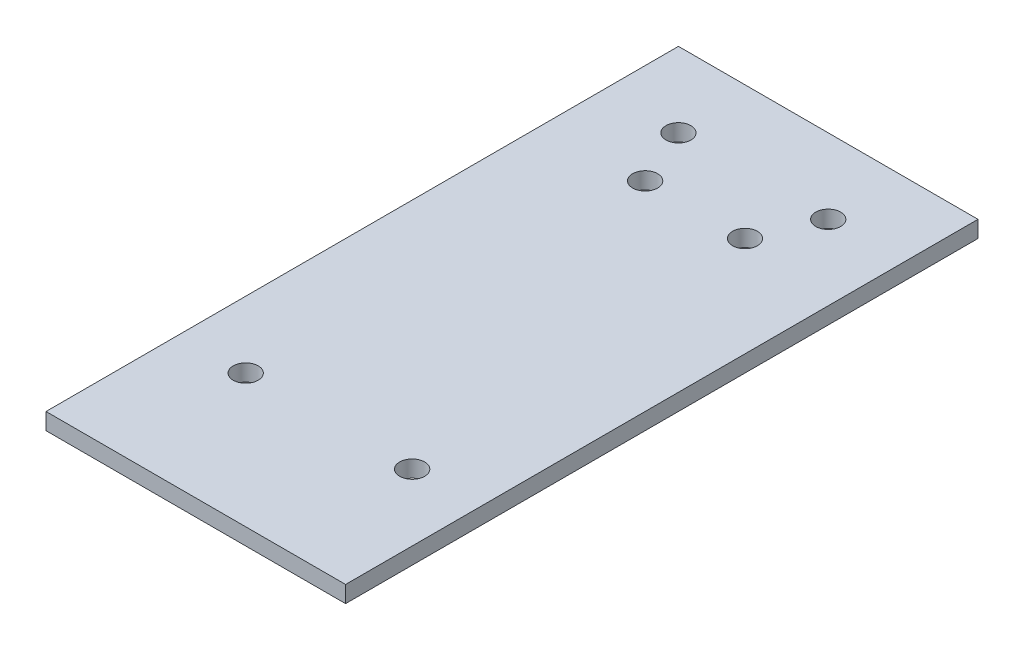
from build123d import *

# Parameters (mm, degrees)
BOSS_EXTRUDE2_DEPTH = 2.5
SKETCH5_R           = 3.75
CUT_EXTRUDE2_DEPTH  = 5
CUT_EXTRUDE3_DEPTH  = 10


with BuildPart() as part:
    # Sketch3 → Boss-Extrude2 (new, symmetric)
    with BuildSketch(Plane(origin=(0, 0, 0), x_dir=(1, 0, 0), z_dir=(0, 1, 0))):
        with BuildLine():
            Line((70, 30), (70, 10))
            ThreePointArc((70, 10), (67.071067812, 2.928932188), (60, 0))
            Line((60, 0), (-60, 0))
            ThreePointArc((-60, 0), (-67.071067812, 2.928932188), (-70, 10))
            Line((-70, 10), (-70, 30))
            ThreePointArc((-70, 30), (-68.535533906, 33.535533906), (-65, 35))
            Line((-65, 35), (-45, 35))
            Line((-45, 35), (-45, 103))
            Line((-45, 103), (-60, 103))
            ThreePointArc((-60, 103), (-67.071067812, 105.928932188), (-70, 113))
            Line((-70, 113), (-70, 147))
            ThreePointArc((-70, 147), (-67.071067812, 154.071067812), (-60, 157))
            Line((-60, 157), (-45, 157))
            Line((-45, 157), (-45, 225))
            Line((-45, 225), (-65.064414928, 225))
            ThreePointArc((-65.064414928, 225), (-68.304785278, 226.192113447), (-70, 229.2))
            Line((-70, 229.2), (-70, 245))
            ThreePointArc((-70, 245), (-66.467868189, 254.855318839), (-57.35, 260))
            Line((-57.35, 260), (57.35, 260))
            ThreePointArc((57.35, 260), (66.467868189, 254.855318839), (70, 245))
            Line((70, 245), (70, 229.2))
            ThreePointArc((70, 229.2), (68.304785278, 226.192113447), (65.064414928, 225))
            Line((65.064414928, 225), (45, 225))
            Line((45, 225), (45, 157))
            Line((45, 157), (60, 157))
            ThreePointArc((60, 157), (67.071067812, 154.071067812), (70, 147))
            Line((70, 147), (70, 113))
            ThreePointArc((70, 113), (67.071067812, 105.928932188), (60, 103))
            Line((60, 103), (45, 103))
            Line((45, 103), (45, 35))
            Line((45, 35), (65, 35))
            ThreePointArc((65, 35), (68.535533906, 33.535533906), (70, 30))
        make_face()
    extrude(amount=BOSS_EXTRUDE2_DEPTH, both=True)

    # Sketch5 → Cut-Extrude2 (cut)
    with BuildSketch(Plane(origin=(0, 2.5, 0), x_dir=(1, 0, 0), z_dir=(0, 1, 0))):
        with Locations(Location((-25, 75, 0), (0, 0, 270))):
            Circle(SKETCH5_R)
        with Locations(Location((-22.5, 202.5, 0), (0, 0, 270))):
            Circle(SKETCH5_R)
        with Locations(Location((-15, 185, 0), (0, 0, 270))):
            Circle(SKETCH5_R)
        with Locations(Location((25, 75, 0), (0, 0, 270))):
            Circle(SKETCH5_R)
        with Locations(Location((15, 185, 0), (0, 0, 270))):
            Circle(SKETCH5_R)
        with Locations(Location((22.5, 202.5, 0), (0, 0, 270))):
            Circle(SKETCH5_R)
    extrude(amount=-CUT_EXTRUDE2_DEPTH, mode=Mode.SUBTRACT)

    # Sketch6 → Cut-Extrude3 (cut)
    with BuildSketch(Plane(origin=(0, 2.5, 0), x_dir=(1, 0, 0), z_dir=(0, 1, 0))):
        with BuildLine():
            Line((-45, 157), (-45, 103))
            Line((-45, 103), (-60, 103))
            ThreePointArc((-60, 103), (-67.071067812, 105.928932188), (-70, 113))
            Line((-70, 113), (-70, 147))
            ThreePointArc((-70, 147), (-67.071067812, 154.071067812), (-60, 157))
            Line((-60, 157), (-45, 157))
        make_face()
        with BuildLine():
            Line((-45, 35), (45, 35))
            Line((45, 35), (65, 35))
            ThreePointArc((65, 35), (68.535533906, 33.535533906), (70, 30))
            Line((70, 30), (70, 10))
            ThreePointArc((70, 10), (67.071067812, 2.928932188), (60, 0))
            Line((60, 0), (-60, 0))
            ThreePointArc((-60, 0), (-67.071067812, 2.928932188), (-70, 10))
            Line((-70, 10), (-70, 30))
            ThreePointArc((-70, 30), (-68.535533906, 33.535533906), (-65, 35))
            Line((-65, 35), (-45, 35))
        make_face()
        with BuildLine():
            Line((45, 157), (45, 103))
            Line((45, 103), (60, 103))
            ThreePointArc((60, 103), (67.071067812, 105.928932188), (70, 113))
            Line((70, 113), (70, 147))
            ThreePointArc((70, 147), (67.071067812, 154.071067812), (60, 157))
            Line((60, 157), (45, 157))
        make_face()
        with BuildLine():
            Line((-45, 225), (45, 225))
            Line((45, 225), (65.064414928, 225))
            ThreePointArc((65.064414928, 225), (68.304785278, 226.192113447), (70, 229.2))
            Line((70, 229.2), (70, 245))
            ThreePointArc((70, 245), (66.467868189, 254.855318839), (57.35, 260))
            Line((57.35, 260), (-57.35, 260))
            ThreePointArc((-57.35, 260), (-66.467868189, 254.855318839), (-70, 245))
            Line((-70, 245), (-70, 229.2))
            ThreePointArc((-70, 229.2), (-68.304785278, 226.192113447), (-65.064414928, 225))
            Line((-65.064414928, 225), (-45, 225))
        make_face()
    extrude(amount=-CUT_EXTRUDE3_DEPTH, mode=Mode.SUBTRACT)


solid = part.part
